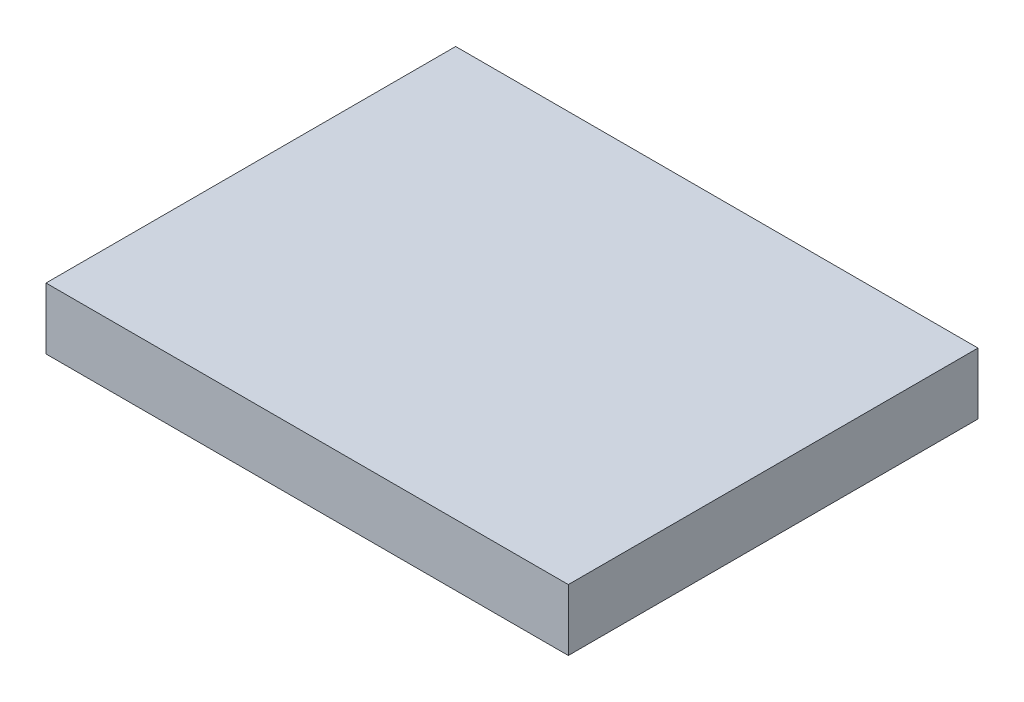
from build123d import *

# Parameters (mm, degrees)
SKETCH_1_W      = 51
SKETCH_1_H      = 40
EXTRUDE_1_DEPTH = 6


with BuildPart() as part:
    # 草图1 → 凸台-拉伸1 (new body)
    with BuildSketch(Plane(origin=(0, 0, 0), x_dir=(1, 0, 0), z_dir=(0, 1, 0))):
        Rectangle(SKETCH_1_W, SKETCH_1_H)
    extrude(amount=EXTRUDE_1_DEPTH)


solid = part.part
